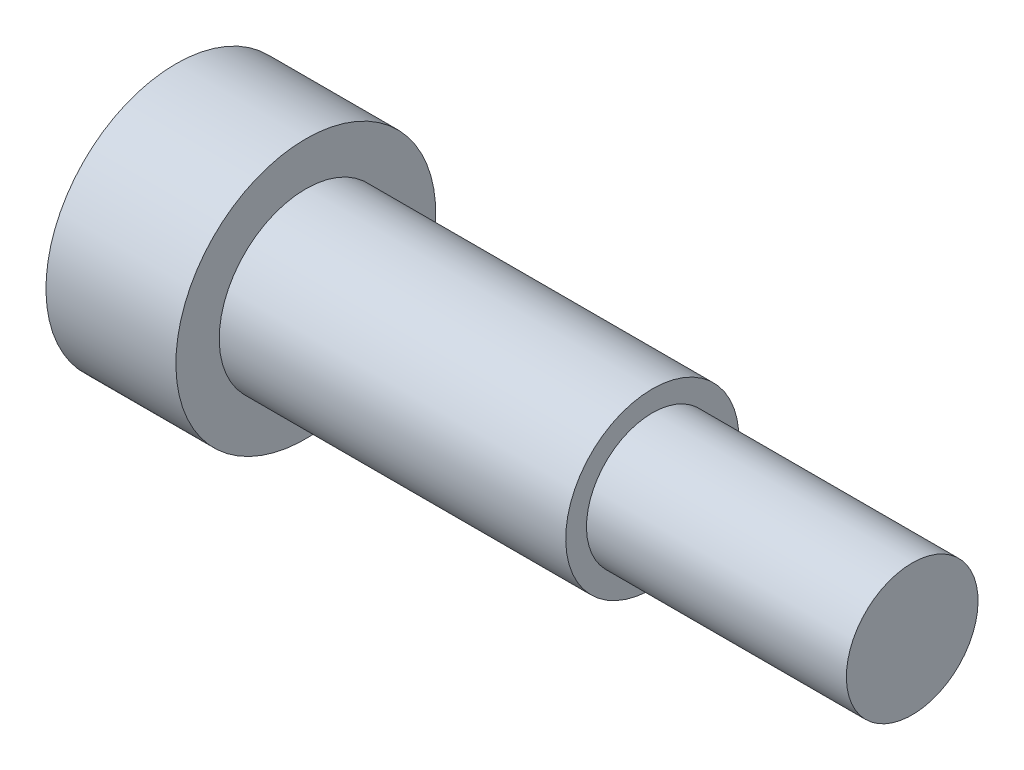
from build123d import *


with BuildPart() as part:
    # Sketch1 → Revolve1 (revolve)
    with BuildSketch(Plane.XY):
        Polygon((0, 4.7625), (4.7625, 4.7625), (4.7625, 3.175), (17.4625, 3.175), (17.4625, 2.413), (26.9875, 2.413), (26.9875, 0), (0, 0), align=None)
    revolve(axis=Axis((26.9875, 0, 0), (-1, 0, 0)))


solid = part.part
